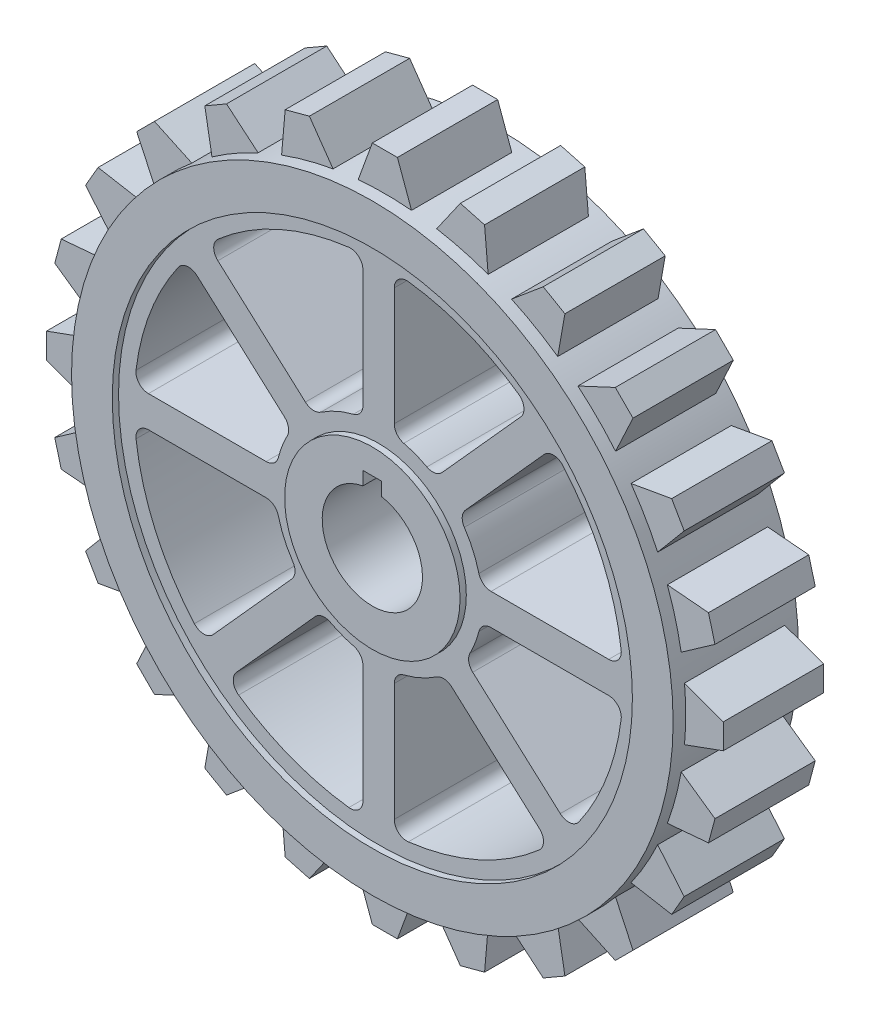
from build123d import *

# Parameters (mm, degrees)
SZKIC3_R                      = 48
SZKIC3_R_2                    = 41.5
DODANIE_WYCI_GNI_CIE1_DEPTH   = 20
SZKIC3_R_3                    = 14
DODANIE_WYCI_GNI_CIE1_2_DEPTH = 20
SZKIC4_R                      = 41.5
SZKIC4_R_2                    = 39
SZKIC4_R_3                    = 16.5
SZKIC4_R_4                    = 14
DODANIE_WYCI_GNI_CIE2_DEPTH   = 18
DODANIE_WYCI_GNI_CIE3_DEPTH   = 16
SZYK_KO_OWY1_COUNT            = 24


with BuildPart() as part:
    # Szkic3 → Dodanie-wyciągnięcie1 (new body)
    with BuildSketch(Plane.XY.offset(-1)):
        Circle(SZKIC3_R)
        Circle(SZKIC3_R_2, mode=Mode.SUBTRACT)
    extrude(amount=DODANIE_WYCI_GNI_CIE1_DEPTH)



with BuildPart() as body_2:
    # Szkic3 → Dodanie-wyci_gni_cie1 2 (new body)
    with BuildSketch(Plane.XY.offset(-1)):
        Circle(SZKIC3_R_3)
        with BuildLine():
            Line((-1.5, 7.858116823), (-1.5, 10))
            Line((-1.5, 10), (1.5, 10))
            Line((1.5, 10), (1.5, 7.858116823))
            ThreePointArc((1.5, 7.858116823), (6.164414003, 5.099019514), (8, 0))
            ThreePointArc((8, 0), (-5.099019514, -6.164414003), (-1.5, 7.858116823))
        make_face(mode=Mode.SUBTRACT)
    extrude(amount=DODANIE_WYCI_GNI_CIE1_2_DEPTH)


with BuildPart() as part_1:
    add(part.part)

    add(body_2.part)  # Dodanie-wyciągnięcie2 merges body 2
    # Szkic4 → Dodanie-wyciągnięcie2 (add)
    # profile 1 of 10: a face of its own
    with BuildSketch(Plane.XY):
        Circle(SZKIC4_R)
        Circle(SZKIC4_R_2, mode=Mode.SUBTRACT)
    # profile 2 of 10: a face of its own
    with BuildSketch(Plane.XY):
        with BuildLine():
            ThreePointArc((-36.725331857, 2.5), (-38.223077911, 3.174572991), (-38.71048493, 4.743243243))
            ThreePointArc((-38.71048493, 4.743243243), (-39, 0), (-38.71048493, -4.743243243))
            ThreePointArc((-38.71048493, -4.743243243), (-38.223077911, -3.174572991), (-36.725331857, -2.5))
            Line((-36.725331857, -2.5), (-17.944358445, -2.5))
            ThreePointArc((-17.944358445, -2.5), (-16.714109074, -2.923140309), (-16.004427802, -4.013513514))
            ThreePointArc((-16.004427802, -4.013513514), (-16.5, 0), (-16.004427802, 4.013513514))
            ThreePointArc((-16.004427802, 4.013513514), (-16.714109074, 2.923140309), (-17.944358445, 2.5))
            Line((-17.944358445, 2.5), (-36.725331857, 2.5))
        make_face()
    # profile 3 of 10: a face of its own
    with BuildSketch(Plane.XY):
        with BuildLine():
            ThreePointArc((-25.650087111, 26.402140655), (-26.313497194, 27.904864524), (-25.627798643, 29.397549842))
            ThreePointArc((-25.627798643, 29.397549842), (-29.012929303, 26.06242378), (-31.96730713, 22.340350823))
            ThreePointArc((-31.96730713, 22.340350823), (-30.556423687, 23.181599819), (-28.991423493, 22.682534335))
            Line((-28.991423493, 22.682534335), (-15.01985801, 10.131824384))
            ThreePointArc((-15.01985801, 10.131824384), (-14.387420165, 8.994905915), (-14.588133908, 7.709497331))
            ThreePointArc((-14.588133908, 7.709497331), (-12.274700859, 11.026410061), (-9.223934419, 13.680973425))
            ThreePointArc((-9.223934419, 13.680973425), (-10.48054214, 13.344078382), (-11.678521628, 13.851430705))
            Line((-11.678521628, 13.851430705), (-25.650087111, 26.402140655))
        make_face()
    # profile 4 of 10: a face of its own
    with BuildSketch(Plane.XY):
        Circle(SZKIC4_R_3)
        Circle(SZKIC4_R_4, mode=Mode.SUBTRACT)
    # profile 5 of 10: a face of its own
    with BuildSketch(Plane.XY):
        with BuildLine():
            Line((2.5, 17.944358445), (2.5, 36.725331857))
            ThreePointArc((2.5, 36.725331857), (3.174572991, 38.223077911), (4.743243243, 38.71048493))
            ThreePointArc((4.743243243, 38.71048493), (0, 39), (-4.743243243, 38.71048493))
            ThreePointArc((-4.743243243, 38.71048493), (-3.174572991, 38.223077911), (-2.5, 36.725331857))
            Line((-2.5, 36.725331857), (-2.5, 17.944358445))
            ThreePointArc((-2.5, 17.944358445), (-2.923140309, 16.714109074), (-4.013513514, 16.004427802))
            ThreePointArc((-4.013513514, 16.004427802), (0, 16.5), (4.013513514, 16.004427802))
            ThreePointArc((4.013513514, 16.004427802), (2.923140309, 16.714109074), (2.5, 17.944358445))
        make_face()
    # profile 6 of 10: a face of its own
    with BuildSketch(Plane.XY):
        with BuildLine():
            ThreePointArc((29.397549842, 25.627798643), (26.06242378, 29.012929303), (22.340350823, 31.96730713))
            ThreePointArc((22.340350823, 31.96730713), (23.181599819, 30.556423687), (22.682534335, 28.991423493))
            Line((22.682534335, 28.991423493), (10.131824384, 15.01985801))
            ThreePointArc((10.131824384, 15.01985801), (8.994905915, 14.387420165), (7.709497331, 14.588133908))
            ThreePointArc((7.709497331, 14.588133908), (11.026410061, 12.274700859), (13.680973425, 9.223934419))
            ThreePointArc((13.680973425, 9.223934419), (13.344078382, 10.48054214), (13.851430705, 11.678521628))
            Line((13.851430705, 11.678521628), (26.402140655, 25.650087111))
            ThreePointArc((26.402140655, 25.650087111), (27.904864524, 26.313497194), (29.397549842, 25.627798643))
        make_face()
    # profile 7 of 10: a face of its own
    with BuildSketch(Plane.XY):
        with BuildLine():
            ThreePointArc((39, 0), (38.927553945, 2.376035324), (38.71048493, 4.743243243))
            ThreePointArc((38.71048493, 4.743243243), (38.223077911, 3.174572991), (36.725331857, 2.5))
            Line((36.725331857, 2.5), (17.944358445, 2.5))
            ThreePointArc((17.944358445, 2.5), (16.714109074, 2.923140309), (16.004427802, 4.013513514))
            ThreePointArc((16.004427802, 4.013513514), (16.375638289, 2.021996694), (16.5, 0))
            ThreePointArc((16.5, 0), (16.375638289, -2.021996694), (16.004427802, -4.013513514))
            ThreePointArc((16.004427802, -4.013513514), (16.714109074, -2.923140309), (17.944358445, -2.5))
            Line((17.944358445, -2.5), (36.725331857, -2.5))
            ThreePointArc((36.725331857, -2.5), (38.223077911, -3.174572991), (38.71048493, -4.743243243))
            ThreePointArc((38.71048493, -4.743243243), (38.927553945, -2.376035324), (39, 0))
        make_face()
    # profile 8 of 10: a face of its own
    with BuildSketch(Plane.XY):
        with BuildLine():
            ThreePointArc((25.627798643, -29.397549842), (29.012929303, -26.06242378), (31.96730713, -22.340350823))
            ThreePointArc((31.96730713, -22.340350823), (30.556423687, -23.181599819), (28.991423493, -22.682534335))
            Line((28.991423493, -22.682534335), (15.01985801, -10.131824384))
            ThreePointArc((15.01985801, -10.131824384), (14.387420165, -8.994905915), (14.588133908, -7.709497331))
            ThreePointArc((14.588133908, -7.709497331), (12.274700859, -11.026410061), (9.223934419, -13.680973425))
            ThreePointArc((9.223934419, -13.680973425), (10.48054214, -13.344078382), (11.678521628, -13.851430705))
            Line((11.678521628, -13.851430705), (25.650087111, -26.402140655))
            ThreePointArc((25.650087111, -26.402140655), (26.313497194, -27.904864524), (25.627798643, -29.397549842))
        make_face()
    # profile 9 of 10: a face of its own
    with BuildSketch(Plane.XY):
        with BuildLine():
            ThreePointArc((-4.743243243, -38.71048493), (0, -39), (4.743243243, -38.71048493))
            ThreePointArc((4.743243243, -38.71048493), (3.174572991, -38.223077911), (2.5, -36.725331857))
            Line((2.5, -36.725331857), (2.5, -17.944358445))
            ThreePointArc((2.5, -17.944358445), (2.923140309, -16.714109074), (4.013513514, -16.004427802))
            ThreePointArc((4.013513514, -16.004427802), (0, -16.5), (-4.013513514, -16.004427802))
            ThreePointArc((-4.013513514, -16.004427802), (-2.923140309, -16.714109074), (-2.5, -17.944358445))
            Line((-2.5, -17.944358445), (-2.5, -36.725331857))
            ThreePointArc((-2.5, -36.725331857), (-3.174572991, -38.223077911), (-4.743243243, -38.71048493))
        make_face()
    # profile 10 of 10: a face of its own
    with BuildSketch(Plane.XY):
        with BuildLine():
            ThreePointArc((-26.402140655, -25.650087111), (-27.904864524, -26.313497194), (-29.397549842, -25.627798643))
            ThreePointArc((-29.397549842, -25.627798643), (-26.06242378, -29.012929303), (-22.340350823, -31.96730713))
            ThreePointArc((-22.340350823, -31.96730713), (-23.181599819, -30.556423687), (-22.682534335, -28.991423493))
            Line((-22.682534335, -28.991423493), (-10.131824384, -15.01985801))
            ThreePointArc((-10.131824384, -15.01985801), (-8.994905915, -14.387420165), (-7.709497331, -14.588133908))
            ThreePointArc((-7.709497331, -14.588133908), (-11.026410061, -12.274700859), (-13.680973425, -9.223934419))
            ThreePointArc((-13.680973425, -9.223934419), (-13.344078382, -10.48054214), (-13.851430705, -11.678521628))
            Line((-13.851430705, -11.678521628), (-26.402140655, -25.650087111))
        make_face()
    extrude(amount=DODANIE_WYCI_GNI_CIE2_DEPTH)

    # Szkic6 → Dodanie-wyciągnięcie3 (add)
    with BuildSketch(Plane.XY.offset(1)):
        with BuildLine():
            Line((0, 54), (0, 48))
            ThreePointArc((0, 48), (2.12835283, 47.952790474), (4.252519055, 47.81125476))
            Line((4.252519055, 47.81125476), (2, 54))
            Line((2, 54), (0, 54))
        make_face()
        with BuildLine():
            ThreePointArc((-4.252519055, 47.81125476), (-2.12835283, 47.952790474), (0, 48))
            Line((0, 48), (0, 54))
            Line((0, 54), (-2, 54))
            Line((-2, 54), (-4.252519055, 47.81125476))
        make_face()
    dodanie_wyci_gni_cie3 = extrude(amount=DODANIE_WYCI_GNI_CIE3_DEPTH)

    # Szyk kołowy1: Dodanie-wyciągnięcie3 ×24 about axis
    szyk_ko_owy1_axis = Axis((0, 0, 0), (0, 0, 1))
    for i in range(1, SZYK_KO_OWY1_COUNT):
        add(dodanie_wyci_gni_cie3.rotate(szyk_ko_owy1_axis, i * 360 / SZYK_KO_OWY1_COUNT))


solid = part_1.part
